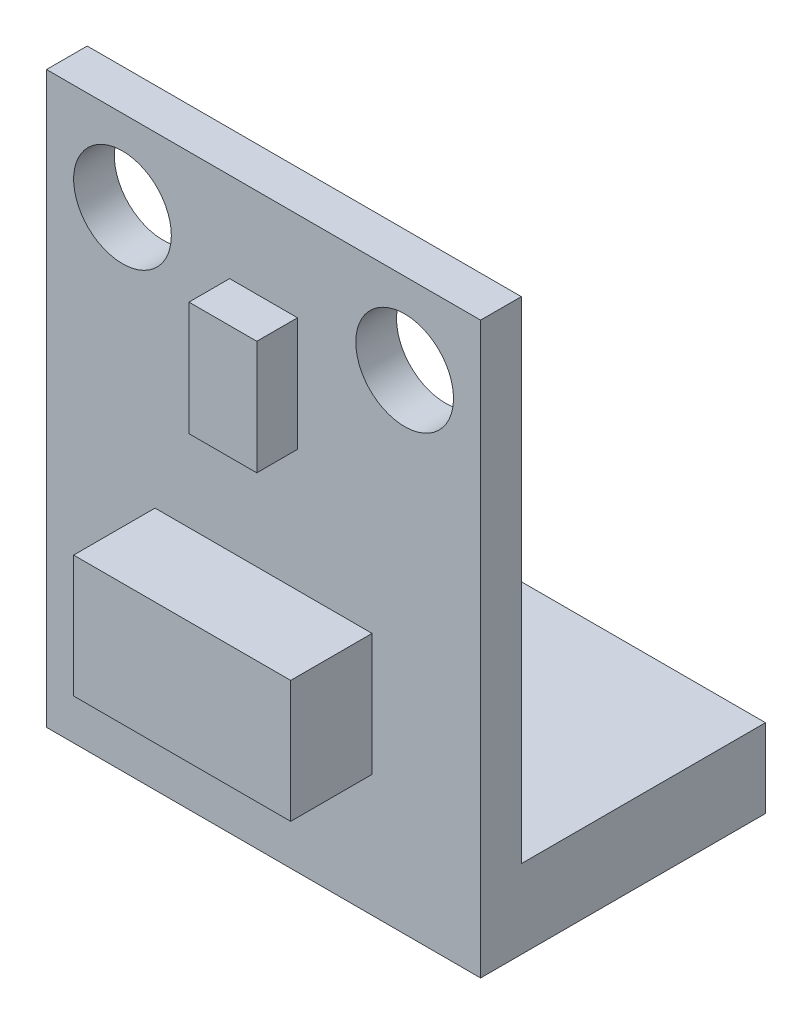
from build123d import *

# Parameters (mm, degrees)
SKETCH1_W           = 16
SKETCH1_H           = 21
SKETCH1_R           = 1.8
BOSS_EXTRUDE1_DEPTH = 1.5
SKETCH2_W           = 2.5
SKETCH2_H           = 4.2
BOSS_EXTRUDE2_DEPTH = 1.5
SKETCH3_W           = 8
SKETCH3_H           = 4.5
BOSS_EXTRUDE3_DEPTH = 3
SKETCH4_W           = 16
SKETCH4_H           = 2.9
BOSS_EXTRUDE4_DEPTH = 9


with BuildPart() as part:
    # Sketch1 → Boss-Extrude1 (new body)
    with BuildSketch(Plane.XY):
        Rectangle(SKETCH1_W, SKETCH1_H)
        with Locations((-5.2, 7.5)):
            Circle(SKETCH1_R, mode=Mode.SUBTRACT)
        with Locations(Location((5.2, 7.5, 0), (0, 0, 180))):
            Circle(SKETCH1_R, mode=Mode.SUBTRACT)
    extrude(amount=BOSS_EXTRUDE1_DEPTH)

    # Sketch2 → Boss-Extrude2 (add)
    with BuildSketch(Plane.XY.offset(1.5)):
        with Locations((0, 5.1)):
            Rectangle(SKETCH2_W, SKETCH2_H)
    extrude(amount=BOSS_EXTRUDE2_DEPTH)

    # Sketch3 → Boss-Extrude3 (add)
    with BuildSketch(Plane.XY.offset(1.5)):
        with Locations((0, -3.75)):
            Rectangle(SKETCH3_W, SKETCH3_H)
    extrude(amount=BOSS_EXTRUDE3_DEPTH)

    # Sketch4 → Boss-Extrude4 (add)
    with BuildSketch(Plane(origin=(0, 0, 0), x_dir=(-1, 0, 0), z_dir=(0, 0, -1))):
        with Locations((0, -9.05)):
            Rectangle(SKETCH4_W, SKETCH4_H)
    extrude(amount=BOSS_EXTRUDE4_DEPTH)


solid = part.part
